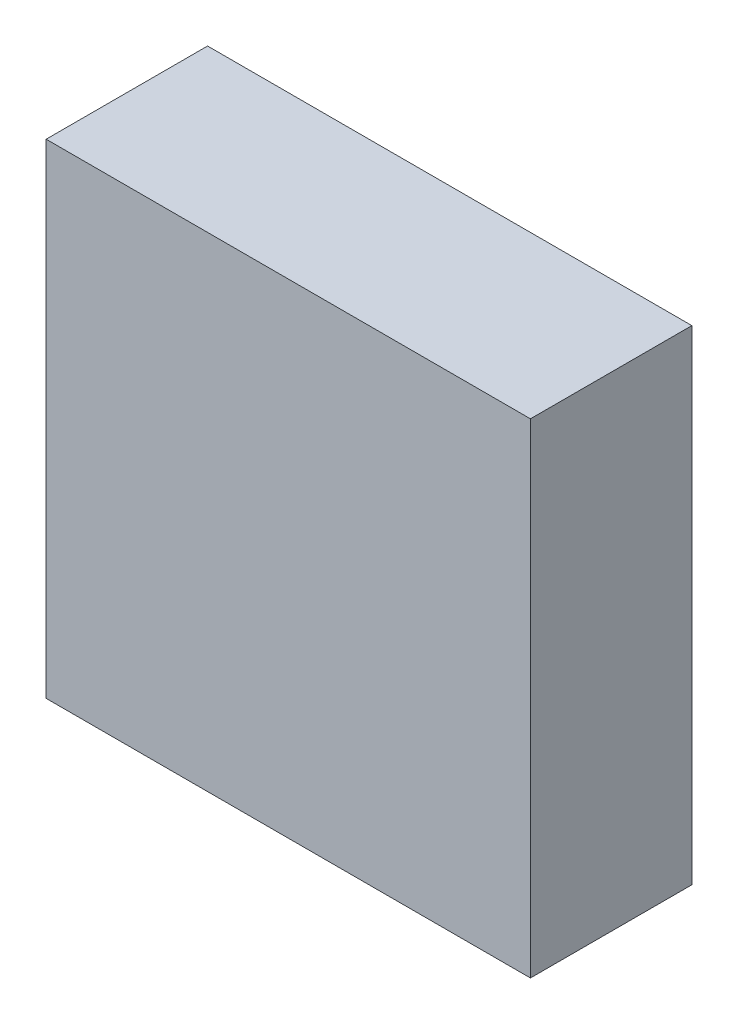
from build123d import *

# Parameters (mm, degrees)
SKETCH1_W           = 300
SKETCH1_H           = 300
BOSS_EXTRUDE1_DEPTH = 100


with BuildPart() as part:
    # Sketch1 → Boss-Extrude1 (new body)
    with BuildSketch(Plane.XY):
        with Locations((-78.197674419, -129.215116279)):
            Rectangle(SKETCH1_W, SKETCH1_H)
    extrude(amount=BOSS_EXTRUDE1_DEPTH)


solid = part.part
